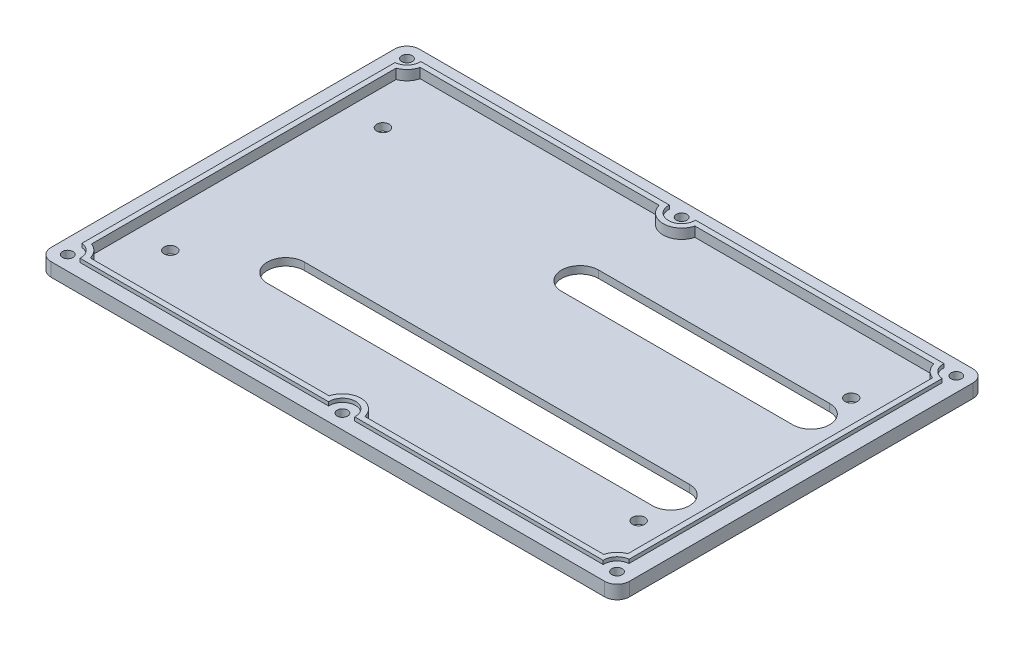
from build123d import *

# Parameters (mm, degrees)
BOSS_EXTRUDE1_DEPTH           = 4.4
CUT_EXTRUDE1_DEPTH            = 2
BOSS_EXTRUDE3_START           = 1.2
BOSS_EXTRUDE3_DEPTH           = 1.2
CSK_FOR_M3_SFHCS1_D           = 3.4
CSK_FOR_M3_SFHCS1_CSINK_D     = 6.72
CSK_FOR_M3_SFHCS1_CSINK_ANGLE = 90
CUT_EXTRUDE2_DEPTH            = 112.396790798
F_4_0_4_DIAMETER_HOLE1_D      = 4


with BuildPart() as part:
    # Sketch1 → Boss-Extrude1 (new body)
    with BuildSketch(Plane(origin=(0, 0, 0), x_dir=(1, 0, 0), z_dir=(0, 1, 0))):
        with BuildLine():
            Line((-89.85, 59.75), (89.85, 59.75))
            ThreePointArc((89.85, 59.75), (92.678427125, 58.578427125), (93.85, 55.75))
            Line((93.85, 55.75), (93.85, -55.75))
            ThreePointArc((93.85, -55.75), (92.678427125, -58.578427125), (89.85, -59.75))
            Line((89.85, -59.75), (-89.85, -59.75))
            ThreePointArc((-89.85, -59.75), (-92.678427125, -58.578427125), (-93.85, -55.75))
            Line((-93.85, -55.75), (-93.85, 55.75))
            ThreePointArc((-93.85, 55.75), (-92.678427125, 58.578427125), (-89.85, 59.75))
        make_face()
    extrude(amount=BOSS_EXTRUDE1_DEPTH)

    # Sketch2 → Cut-Extrude1 (cut)
    with BuildSketch(Plane(origin=(0, 4.4, 0), x_dir=(1, 0, 0), z_dir=(0, 1, 0))):
        with BuildLine():
            Line((-83.340524981, -53.55), (-5.809475019, -53.55))
            ThreePointArc((-5.809475019, -53.55), (0, -49.05), (5.809475019, -53.55))
            Line((5.809475019, -53.55), (83.340524981, -53.55))
            ThreePointArc((83.340524981, -53.55), (84.690787612, -51.035597818), (87.05, -49.429501801))
            Line((87.05, -49.429501801), (87.05, 49.429501801))
            ThreePointArc((87.05, 49.429501801), (84.690787612, 51.035597818), (83.340524981, 53.55))
            Line((83.340524981, 53.55), (5.809475019, 53.55))
            ThreePointArc((5.809475019, 53.55), (0, 49.05), (-5.809475019, 53.55))
            Line((-5.809475019, 53.55), (-83.340524981, 53.55))
            ThreePointArc((-83.340524981, 53.55), (-84.690787612, 51.035597818), (-87.05, 49.429501801))
            Line((-87.05, 49.429501801), (-87.05, -49.429501801))
            ThreePointArc((-87.05, -49.429501801), (-84.690787612, -51.035597818), (-83.340524981, -53.55))
        make_face()
    extrude(amount=-CUT_EXTRUDE1_DEPTH, mode=Mode.SUBTRACT)

    # Sketch3 → Boss-Extrude3 (add)
    with BuildSketch(Plane(origin=(0, 4.4, 0), x_dir=(1, 0, 0), z_dir=(0, 1, 0)).offset(BOSS_EXTRUDE3_START)):
        with BuildLine():
            Line((-88.8, 50.814436283), (-88.8, -50.814436283))
            ThreePointArc((-88.8, -50.814436283), (-85.940146797, -52.264440377), (-84.907359313, -55.3))
            Line((-84.907359313, -55.3), (-4.242640687, -55.3))
            ThreePointArc((-4.242640687, -55.3), (0, -50.8), (4.242640687, -55.3))
            Line((4.242640687, -55.3), (84.907359313, -55.3))
            ThreePointArc((84.907359313, -55.3), (85.940146797, -52.264440377), (88.8, -50.814436283))
            Line((88.8, -50.814436283), (88.8, 50.814436283))
            ThreePointArc((88.8, 50.814436283), (85.940146797, 52.264440377), (84.907359313, 55.3))
            Line((84.907359313, 55.3), (4.242640687, 55.3))
            ThreePointArc((4.242640687, 55.3), (0, 50.8), (-4.242640687, 55.3))
            Line((-4.242640687, 55.3), (-84.907359313, 55.3))
            ThreePointArc((-84.907359313, 55.3), (-85.940146797, 52.264440377), (-88.8, 50.814436283))
        make_face()
        with BuildLine():
            Line((-87.05, 49.429501801), (-87.05, -49.429501801))
            ThreePointArc((-87.05, -49.429501801), (-84.690787612, -51.035597818), (-83.340524981, -53.55))
            Line((-83.340524981, -53.55), (-5.809475019, -53.55))
            ThreePointArc((-5.809475019, -53.55), (0, -49.05), (5.809475019, -53.55))
            Line((5.809475019, -53.55), (83.340524981, -53.55))
            ThreePointArc((83.340524981, -53.55), (84.690787612, -51.035597818), (87.05, -49.429501801))
            Line((87.05, -49.429501801), (87.05, 49.429501801))
            ThreePointArc((87.05, 49.429501801), (84.690787612, 51.035597818), (83.340524981, 53.55))
            Line((83.340524981, 53.55), (5.809475019, 53.55))
            ThreePointArc((5.809475019, 53.55), (0, 49.05), (-5.809475019, 53.55))
            Line((-5.809475019, 53.55), (-83.340524981, 53.55))
            ThreePointArc((-83.340524981, 53.55), (-84.690787612, 51.035597818), (-87.05, 49.429501801))
        make_face(mode=Mode.SUBTRACT)
    extrude(amount=-BOSS_EXTRUDE3_DEPTH)

    # CSK for M3 SFHCS1 (through all)
    with Locations(Plane(origin=(-54.95207322, 0, 58.575897403), x_dir=(1, 0, 0), z_dir=(0, -1, 0))):
        with Locations((-34.19792678, -113.625897403), (-34.19792678, -3.525897403), (144.10207322, -3.525897403), (144.10207322, -113.625897403), (54.95207322, -3.525897403), (54.95207322, -113.625897403)):
            CounterSinkHole(CSK_FOR_M3_SFHCS1_D / 2, CSK_FOR_M3_SFHCS1_CSINK_D / 2, counter_sink_angle=CSK_FOR_M3_SFHCS1_CSINK_ANGLE)

    # Sketch8 → Cut-Extrude2 (cut, through all)
    with BuildSketch(Plane.XZ):
        with BuildLine():
            Line((-0.65, -16.75), (74.35, -16.75))
            ThreePointArc((74.35, -16.75), (80.35, -22.75), (74.35, -28.75))
            Line((74.35, -28.75), (-0.65, -28.75))
            ThreePointArc((-0.65, -28.75), (-6.65, -22.75), (-0.65, -16.75))
        make_face()
        with BuildLine():
            Line((-50.65, 28.75), (74.35, 28.75))
            ThreePointArc((74.35, 28.75), (80.35, 22.75), (74.35, 16.75))
            Line((74.35, 16.75), (-50.65, 16.75))
            ThreePointArc((-50.65, 16.75), (-56.65, 22.75), (-50.65, 28.75))
        make_face()
    extrude(amount=-CUT_EXTRUDE2_DEPTH, mode=Mode.SUBTRACT)

    # Ø4.0 (4) Diameter Hole1 (through all)
    with Locations(Plane(origin=(0, 0, 0), x_dir=(-1, 0, 0), z_dir=(0, -1, 0))):
        with Locations((75.65, -35.25), (75.65, 33.75), (-76.35, 33.75), (-76.35, -35.25)):
            Hole(F_4_0_4_DIAMETER_HOLE1_D / 2)


solid = part.part
